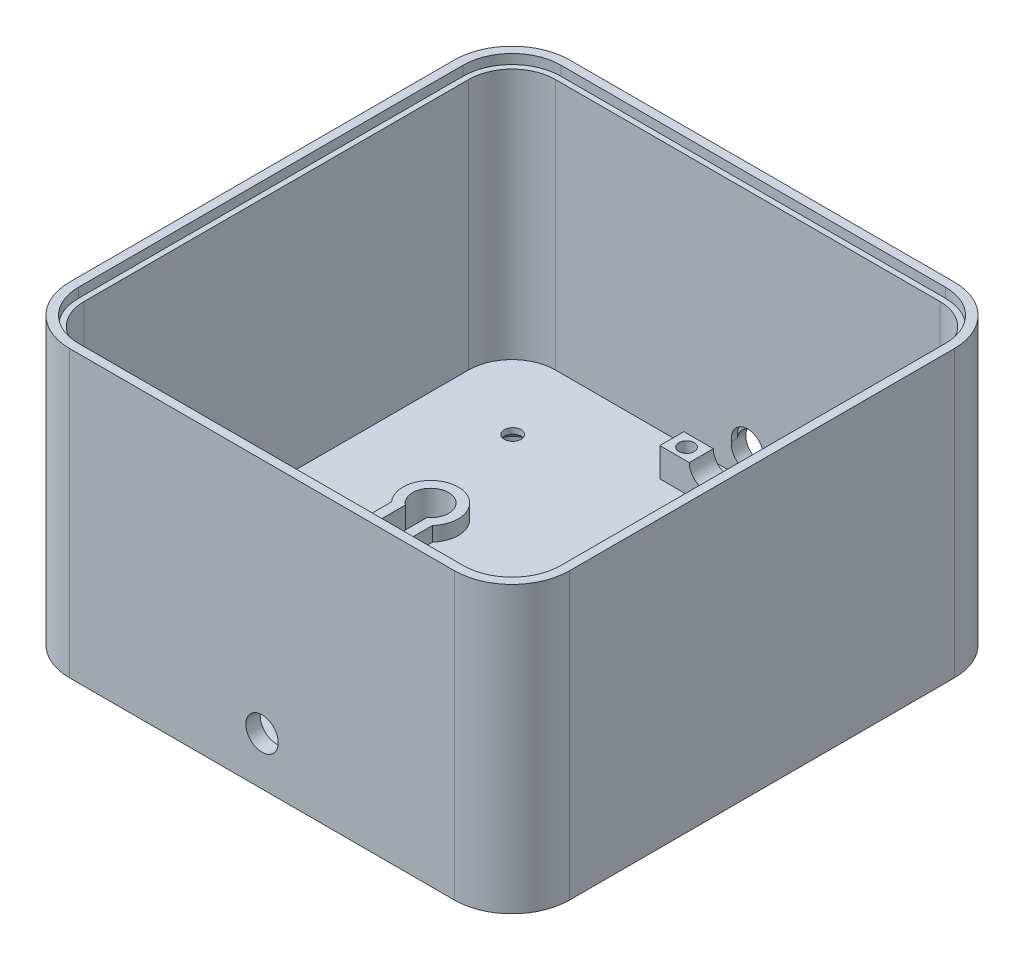
from build123d import *
from OCP.BRepFilletAPI import BRepFilletAPI_MakeChamfer

# Parameters (mm, degrees)
SALIENTE_EXTRUIR1_DEPTH    = 5
SALIENTE_EXTRUIR2_DEPTH    = 54.34
CORTAR_EXTRUIR1_DEPTH      = 2
CORTAR_EXTRUIR2_DEPTH      = 17
SALIENTE_EXTRUIR3_DEPTH    = 3
SALIENTE_EXTRUIR4_DEPTH    = 15
CROQUIS8_W                 = 19
CROQUIS8_H                 = 5
SALIENTE_EXTRUIR5_DEPTH    = 6
CROQUIS10_R                = 3.375837474
CORTAR_EXTRUIR3_DEPTH      = 10
CROQUIS11_R                = 1.6
CORTAR_EXTRUIR4_DEPTH      = 9
CORTAR_EXTRUIR5_DEPTH      = 138
CORTAR_EXTRUIR5_DEPTH_BACK = 9
CROQUIS12_R                = 3.375837474
CROQUIS13_R                = 4
CORTAR_EXTRUIR6_DEPTH      = 2.2
CROQUIS14_R                = 1.75
CORTAR_EXTRUIR7_DEPTH      = 18.2
CHAFL_N1_SIZE              = 1.75
CHAFL_N1_SIZE2             = 1.631901401
CROQUIS15_W                = 2.505679427
CROQUIS15_H                = 5.945679997
SALIENTE_EXTRUIR6_DEPTH    = 6.2
CROQUIS16_R                = 1.576407793
SALIENTE_EXTRUIR7_DEPTH    = 2.2
REDONDEO1_R                = 10


with BuildPart() as part:
    # Croquis1 → Saliente-Extruir1 (new body)
    with BuildSketch(Plane(origin=(0, 0, 0), x_dir=(1, 0, 0), z_dir=(0, 1, 0))):
        with BuildLine():
            Line((12, 0), (92, 0))
            ThreePointArc((92, 0), (100.485281374, 3.514718626), (104, 12))
            Line((104, 12), (104, 92))
            ThreePointArc((104, 92), (100.485281374, 100.485281374), (92, 104))
            Line((92, 104), (12, 104))
            ThreePointArc((12, 104), (3.514718626, 100.485281374), (0, 92))
            Line((0, 92), (0, 12))
            ThreePointArc((0, 12), (3.514718626, 3.514718626), (12, 0))
        make_face()
    extrude(amount=SALIENTE_EXTRUIR1_DEPTH)

    # Croquis2 → Saliente-Extruir2 (add)
    with BuildSketch(Plane(origin=(0, 5, 0), x_dir=(1, 0, 0), z_dir=(0, 1, 0))):
        with BuildLine():
            Line((12, 0), (92, 0))
            ThreePointArc((92, 0), (100.485281374, 3.514718626), (104, 12))
            Line((104, 12), (104, 92))
            ThreePointArc((104, 92), (100.485281374, 100.485281374), (92, 104))
            Line((92, 104), (12, 104))
            ThreePointArc((12, 104), (3.514718626, 100.485281374), (0, 92))
            Line((0, 92), (0, 12))
            ThreePointArc((0, 12), (3.514718626, 3.514718626), (12, 0))
        make_face()
        with BuildLine():
            Line((12, 3), (92, 3))
            ThreePointArc((92, 3), (98.363961031, 5.636038969), (101, 12))
            Line((101, 12), (101, 92))
            ThreePointArc((101, 92), (98.363961031, 98.363961031), (92, 101))
            Line((92, 101), (12, 101))
            ThreePointArc((12, 101), (5.636038969, 98.363961031), (3, 92))
            Line((3, 92), (3, 12))
            ThreePointArc((3, 12), (5.636038969, 5.636038969), (12, 3))
        make_face(mode=Mode.SUBTRACT)
    extrude(amount=SALIENTE_EXTRUIR2_DEPTH)

    # Croquis3 → Cortar-Extruir1 (cut)
    with BuildSketch(Plane(origin=(0, 59.34, 0), x_dir=(1, 0, 0), z_dir=(0, 1, 0))):
        with BuildLine():
            Line((12, 1.85), (92, 1.85))
            ThreePointArc((92, 1.85), (99.177133829, 4.822866171), (102.15, 12))
            Line((102.15, 12), (102.15, 92))
            ThreePointArc((102.15, 92), (99.177133829, 99.177133829), (92, 102.15))
            Line((92, 102.15), (12, 102.15))
            ThreePointArc((12, 102.15), (4.822866171, 99.177133829), (1.85, 92))
            Line((1.85, 92), (1.85, 12))
            ThreePointArc((1.85, 12), (4.822866171, 4.822866171), (12, 1.85))
        make_face()
    extrude(amount=-CORTAR_EXTRUIR1_DEPTH, mode=Mode.SUBTRACT)

    # Croquis4 → Cortar-Extruir2 (cut)
    with BuildSketch(Plane.XZ):
        with BuildLine():
            Line((23.75, -50.33), (23.75, -58.07))
            ThreePointArc((23.75, -58.07), (26, -64.82), (28.25, -58.07))
            Line((28.25, -58.07), (28.25, -50.33))
            ThreePointArc((28.25, -50.33), (26, -48.08), (23.75, -50.33))
        make_face()
        with BuildLine():
            Line((75.75, -50.33), (75.75, -58.07))
            ThreePointArc((75.75, -58.07), (78, -64.82), (80.25, -58.07))
            Line((80.25, -58.07), (80.25, -50.33))
            ThreePointArc((80.25, -50.33), (78, -48.08), (75.75, -50.33))
        make_face()
    extrude(amount=-CORTAR_EXTRUIR2_DEPTH, mode=Mode.SUBTRACT)

    # Croquis5 → Saliente-Extruir3 (add)
    # profile 1 of 2: a face of its own
    with BuildSketch(Plane(origin=(0, 5, 0), x_dir=(1, 0, 0), z_dir=(0, 1, 0))):
        with BuildLine():
            Line((73.75, 50.33), (73.75, 57.197016654))
            ThreePointArc((73.75, 57.197016654), (78, 66.82), (82.25, 57.197016654))
            Line((82.25, 57.197016654), (82.25, 50.33))
            ThreePointArc((82.25, 50.33), (78, 46.08), (73.75, 50.33))
        make_face()
        with BuildLine():
            Line((80.25, 58.07), (80.25, 50.33))
            ThreePointArc((80.25, 50.33), (78, 48.08), (75.75, 50.33))
            Line((75.75, 50.33), (75.75, 58.07))
            ThreePointArc((75.75, 58.07), (78, 64.82), (80.25, 58.07))
        make_face(mode=Mode.SUBTRACT)
    # profile 2 of 2: a face of its own
    with BuildSketch(Plane(origin=(0, 5, 0), x_dir=(1, 0, 0), z_dir=(0, 1, 0))):
        with BuildLine():
            Line((21.75, 50.33), (21.75, 57.197016654))
            ThreePointArc((21.75, 57.197016654), (26, 66.82), (30.25, 57.197016654))
            Line((30.25, 57.197016654), (30.25, 50.33))
            ThreePointArc((30.25, 50.33), (26, 46.08), (21.75, 50.33))
        make_face()
        with BuildLine():
            Line((23.75, 50.33), (23.75, 58.07))
            ThreePointArc((23.75, 58.07), (26, 64.82), (28.25, 58.07))
            Line((28.25, 58.07), (28.25, 50.33))
            ThreePointArc((28.25, 50.33), (26, 48.08), (23.75, 50.33))
        make_face(mode=Mode.SUBTRACT)
    extrude(amount=SALIENTE_EXTRUIR3_DEPTH)

    # Croquis6 → Saliente-Extruir4 (add)
    with BuildSketch(Plane(origin=(0, 5, 0), x_dir=(1, 0, 0), z_dir=(0, 1, 0))):
        Polygon((14.875650125, 40.19005009), (34.675650125, 40.19005009), (34.675650125, 38.19005009), (32.675650125, 38.19005009), (16.875650125, 38.19005009), (16.875650125, 11.39005009), (32.675650125, 11.39005009), (34.675650125, 11.39005009), (34.675650125, 9.39005009), (14.875650125, 9.39005009), align=None)
    extrude(amount=SALIENTE_EXTRUIR4_DEPTH)

    # Croquis8 → Saliente-Extruir5 (add)
    with BuildSketch(Plane(origin=(0, 5, 0), x_dir=(1, 0, 0), z_dir=(0, 1, 0))):
        with Locations((52, 21.390307978)):
            Rectangle(CROQUIS8_W, CROQUIS8_H)
    saliente_extruir5 = extrude(amount=SALIENTE_EXTRUIR5_DEPTH)

    # Croquis10 → Cortar-Extruir3 (cut)
    with BuildSketch(Plane(origin=(0, 0, -23.890307978), x_dir=(-1, 0, 0), z_dir=(0, 0, -1))):
        with Locations((-52, 11)):
            Circle(CROQUIS10_R)
    cortar_extruir3 = extrude(amount=-CORTAR_EXTRUIR3_DEPTH, mode=Mode.SUBTRACT)

    # Croquis11 → Cortar-Extruir4 (cut)
    with BuildSketch(Plane(origin=(0, 11, 0), x_dir=(1, 0, 0), z_dir=(0, 1, 0))):
        with Locations(Location((58.437918737, 21.390307978, 0), (0, 0, 270))):
            Circle(CROQUIS11_R)
        with Locations(Location((45.562081263, 21.390307978, 0), (0, 0, 90))):
            Circle(CROQUIS11_R)
    cortar_extruir4 = extrude(amount=-CORTAR_EXTRUIR4_DEPTH, mode=Mode.SUBTRACT)

    # Croquis12 → Cortar-Extruir5 (cut, two sides: drawn at the far end of the back side and taken through both)
    with BuildSketch(Plane(origin=(0, 0, -3), x_dir=(-1, 0, 0), z_dir=(0, 0, -1)).offset(-CORTAR_EXTRUIR5_DEPTH_BACK)):
        with Locations((-52, 10)):
            Circle(CROQUIS12_R)
    extrude(amount=CORTAR_EXTRUIR5_DEPTH + CORTAR_EXTRUIR5_DEPTH_BACK, mode=Mode.SUBTRACT)

    # Simetría1: Saliente-Extruir5, Cortar-Extruir3, Cortar-Extruir4 across plane
    add(saliente_extruir5.mirror(Plane(origin=(0, 0, -58.07), x_dir=(1, 0, 0), z_dir=(0, 0, -1))))
    add(cortar_extruir3.mirror(Plane(origin=(0, 0, -58.07), x_dir=(1, 0, 0), z_dir=(0, 0, -1))), mode=Mode.SUBTRACT)
    add(cortar_extruir4.mirror(Plane(origin=(0, 0, -58.07), x_dir=(1, 0, 0), z_dir=(0, 0, -1))), mode=Mode.SUBTRACT)

    # Croquis13 → Cortar-Extruir6 (cut)
    with BuildSketch(Plane.XZ):
        with Locations(Location((72.961798257, -32.537586192, 0), (0, 0, 270))):
            Circle(CROQUIS13_R)
        with Locations(Location((86.181647316, -84.558212342, 0), (0, 0, 270))):
            Circle(CROQUIS13_R)
        with Locations(Location((19.210631353, -84.938725209, 0), (0, 0, 270))):
            Circle(CROQUIS13_R)
    extrude(amount=-CORTAR_EXTRUIR6_DEPTH, mode=Mode.SUBTRACT)

    # Croquis14 → Cortar-Extruir7 (cut)
    with BuildSketch(Plane.XZ.offset(-2.2)):
        with Locations(Location((72.961798257, -32.537586192, 0), (0, 0, 270))):
            Circle(CROQUIS14_R)
        with Locations(Location((86.181647316, -84.558212342, 0), (0, 0, 270))):
            Circle(CROQUIS14_R)
        with Locations(Location((19.210631353, -84.938725209, 0), (0, 0, 270))):
            Circle(CROQUIS14_R)
    extrude(amount=-CORTAR_EXTRUIR7_DEPTH, mode=Mode.SUBTRACT)

    # Chaflán1: one chamfer whose edges measure the first distance from different faces: ONE call of the kernel's chamfer builder (chamfer() names one face for all edges)
    chafl_n1_edges_1 = [part.edges().sort_by_distance(p)[0] for p in [
        (72.961798257, 2.2, -30.787586192),
    ]]
    chafl_n1_side_1 = [part.faces().sort_by_distance(p)[0] for p in [
        (72.961798257, 2.2, -28.650723277),
    ]]
    chafl_n1_edges_2 = [part.edges().sort_by_distance(p)[0] for p in [
        (86.181647316, 2.2, -82.808212342),
    ]]
    chafl_n1_side_2 = [part.faces().sort_by_distance(p)[0] for p in [
        (86.181647316, 2.2, -80.671349427),
    ]]
    chafl_n1_edges_3 = [part.edges().sort_by_distance(p)[0] for p in [
        (19.210631353, 2.2, -83.188725209),
    ]]
    chafl_n1_side_3 = [part.faces().sort_by_distance(p)[0] for p in [
        (19.210631353, 2.2, -81.051862294),
    ]]
    chafl_n1 = BRepFilletAPI_MakeChamfer(part.part.solid().wrapped)
    for e in chafl_n1_edges_1:
        chafl_n1.Add(CHAFL_N1_SIZE, CHAFL_N1_SIZE2, e.wrapped, chafl_n1_side_1[0].wrapped)  # the first distance lies on this face
    for e in chafl_n1_edges_2:
        chafl_n1.Add(CHAFL_N1_SIZE, CHAFL_N1_SIZE2, e.wrapped, chafl_n1_side_2[0].wrapped)  # the first distance lies on this face
    for e in chafl_n1_edges_3:
        chafl_n1.Add(CHAFL_N1_SIZE, CHAFL_N1_SIZE2, e.wrapped, chafl_n1_side_3[0].wrapped)  # the first distance lies on this face
    add(Compound.cast(chafl_n1.Shape()), mode=Mode.REPLACE)

    # Croquis15 → Saliente-Extruir6 (add)
    with BuildSketch(Plane(origin=(0, 5, 0), x_dir=(1, 0, 0), z_dir=(0, 1, 0))):
        with Locations((31.675296524, 28.865498451)):
            Rectangle(CROQUIS15_W, CROQUIS15_H)
    extrude(amount=SALIENTE_EXTRUIR6_DEPTH)

    # Croquis16 → Saliente-Extruir7 (add)
    with BuildSketch(Plane(origin=(0, 5, 0), x_dir=(1, 0, 0), z_dir=(0, 1, 0))):
        with BuildLine():
            ThreePointArc((20.979111053, 13.100030069), (19.317879756, 14.761261366), (17.656648458, 13.100030069))
            Line((17.656648458, 13.100030069), (17.656648458, 11.39005009))
            Line((17.656648458, 11.39005009), (20.979111053, 11.39005009))
            Line((20.979111053, 11.39005009), (20.979111053, 13.100030069))
        make_face()
        with Locations(Location((28.220818392, 23.4710535, 0), (0, 0, 90))):
            Circle(CROQUIS16_R)
        with BuildLine():
            Line((24.185453679, 38.19005009), (24.185453679, 36.107269041))
            ThreePointArc((24.185453679, 36.107269041), (25.888394883, 34.404327838), (27.591336086, 36.107269041))
            Line((27.591336086, 36.107269041), (27.591336086, 38.19005009))
            Line((27.591336086, 38.19005009), (24.185453679, 38.19005009))
        make_face()
    extrude(amount=SALIENTE_EXTRUIR7_DEPTH)

    # Redondeo1
    redondeo1_edges = [part.edges().sort_by_distance(p)[0] for p in [
        (34.675650125, 20, -39.19005009),
        (34.675650125, 20, -10.39005009),
    ]]
    fillet(redondeo1_edges, radius=REDONDEO1_R)


solid = part.part
